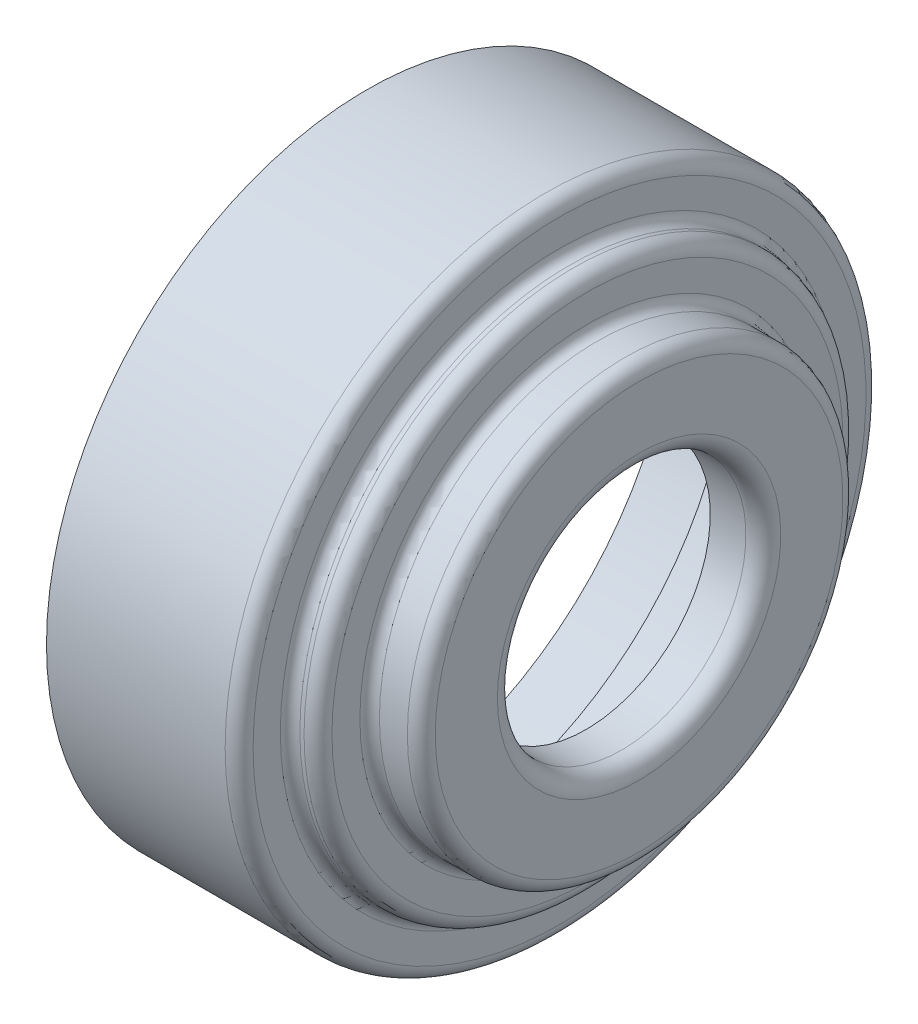
from build123d import *

# Parameters (mm, degrees)
FILLET_1_R = 1.25
FILLET_2_R = 1
FILLET_3_R = 0.7
FILLET_4_R = 0.4
FILLET_5_R = 0.2
FILLET_6_R = 0.6
FILLET_7_R = 2
FILLET_8_R = 0.2


with BuildPart() as part:
    # 草图1 → 旋转1 (revolve)
    with BuildSketch(Plane.XY, mode=Mode.PRIVATE) as revolve_1_sk:
        Polygon((-7, 21.15), (0, 21.15), (0, 17.8), (2, 17.8), (2, 13.6), (5.7, 13.6), (5.7, 9.55), (3.7, 9.55), (3.7, 8.9), (7.5, 8.9), (7.5, 15.6), (3.8, 15.6), (3.8, 19.3), (1.8, 19.3), (1.8, 22.95), (-12, 22.95), (-12, 22.15), (-7, 22.15), align=None)
    revolve(revolve_1_sk.sketch.rotate(Axis((-35.434161491, 0, 0), (1, 0, 0)), 90), axis=Axis((-35.434161491, 0, 0), (1, 0, 0)))

    # 圆角1
    fillet_1_edges = [part.edges().sort_by_distance(p)[0] for p in [
        (7.5, 0, -8.9),
    ]]
    fillet(fillet_1_edges, radius=FILLET_1_R)

    # 圆角2
    fillet_2_edges = [part.edges().sort_by_distance(p)[0] for p in [
        (1.8, 0, -22.95),
        (3.8, 0, -19.3),
        (7.5, 0, -15.6),
    ]]
    fillet(fillet_2_edges, radius=FILLET_2_R)

    # 圆角3
    fillet_3_edges = [part.edges().sort_by_distance(p)[0] for p in [
        (1.8, 0, -19.3),
        (3.8, 0, -15.6),
    ]]
    fillet(fillet_3_edges, radius=FILLET_3_R)

    # 圆角4
    fillet_4_edges = [part.edges().sort_by_distance(p)[0] for p in [
        (5.7, 0, -9.55),
    ]]
    fillet(fillet_4_edges, radius=FILLET_4_R)

    # 圆角5
    fillet_5_edges = [part.edges().sort_by_distance(p)[0] for p in [
        (5.7, 0, -13.6),
    ]]
    fillet(fillet_5_edges, radius=FILLET_5_R)

    # 圆角6
    fillet_6_edges = [part.edges().sort_by_distance(p)[0] for p in [
        (0, 0, -21.15),
        (2, 0, -17.8),
    ]]
    fillet(fillet_6_edges, radius=FILLET_6_R)

    # 圆角7
    fillet_7_edges = [part.edges().sort_by_distance(p)[0] for p in [
        (2, 0, -13.6),
    ]]
    fillet(fillet_7_edges, radius=FILLET_7_R)

    # 圆角8
    fillet_8_edges = [part.edges().sort_by_distance(p)[0] for p in [
        (0, 0, -17.8),
    ]]
    fillet(fillet_8_edges, radius=FILLET_8_R)


solid = part.part
